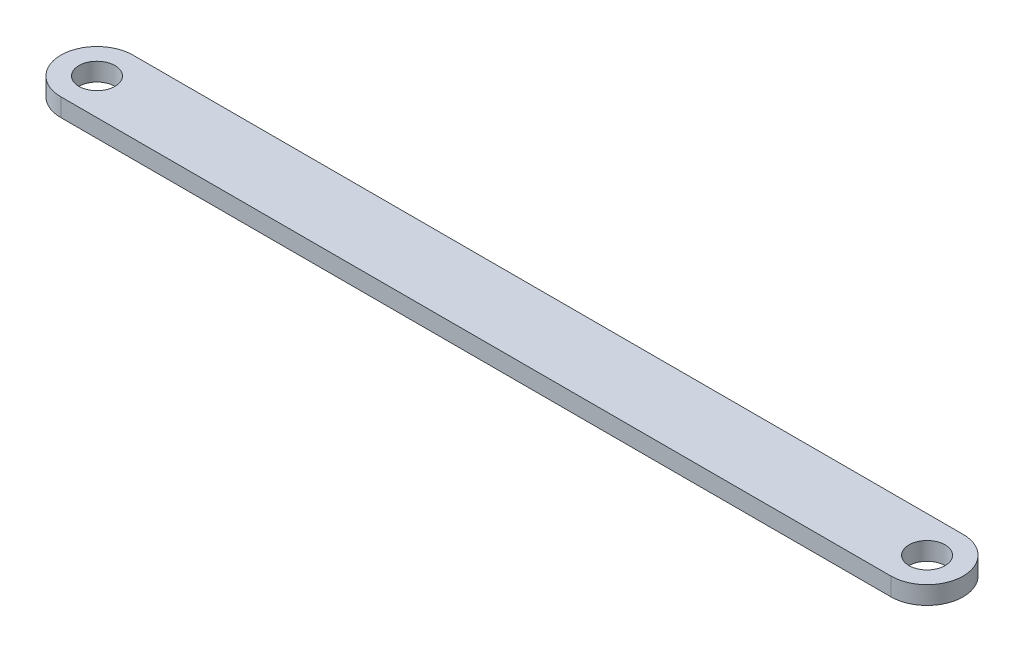
from build123d import *

# Parameters (mm, degrees)
SKETCH1_R           = 5
BOSS_EXTRUDE1_DEPTH = 5


with BuildPart() as part:
    # Sketch1 → Boss-Extrude1 (new body)
    with BuildSketch(Plane(origin=(0, 0, 0), x_dir=(1, 0, 0), z_dir=(0, 1, 0))):
        with BuildLine():
            Line((-72.346809709, 10), (157.653190291, 10))
            ThreePointArc((157.653190291, 10), (167.653190291, 0), (157.653190291, -10))
            Line((157.653190291, -10), (-72.346809709, -10))
            ThreePointArc((-72.346809709, -10), (-82.346809709, 0), (-72.346809709, 10))
        make_face()
        with Locations(Location((-72.346809709, 0, 0), (0, 0, 270))):
            Circle(SKETCH1_R, mode=Mode.SUBTRACT)
        with Locations(Location((157.653190291, 0, 0), (0, 0, 270))):
            Circle(SKETCH1_R, mode=Mode.SUBTRACT)
    extrude(amount=BOSS_EXTRUDE1_DEPTH)


solid = part.part
